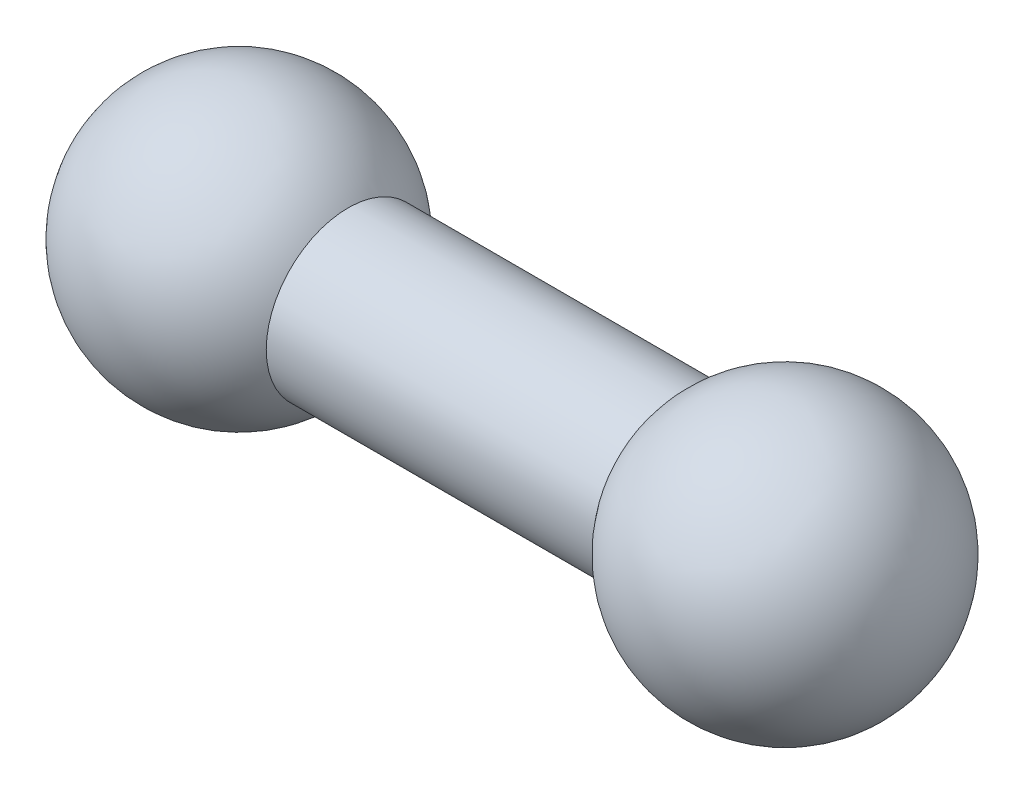
from build123d import *

# Parameters (mm, degrees)
SKETCH5_R   = 1.5
SHAFT_DEPTH = 10


with BuildPart() as part:
    # Sketch4 → Semi-circle Revolve (revolve)
    with BuildSketch(Plane(origin=(0, 0, 0), x_dir=(0, 0, -1), z_dir=(1, 0, 0))):
        with BuildLine():
            Line((0, 0), (2.5, 0))
            Line((2.5, 0), (2.5, -2.5))
            ThreePointArc((2.5, -2.5), (0.732233047, -1.767766953), (0, 0))
        make_face()
    semi_circle_revolve = revolve(axis=Axis((0, 0, -2.5), (0, -1, 0)))

    # Full-circle Mirror: Semi-circle Revolve across plane
    add(semi_circle_revolve.mirror(Plane(origin=(0, 0, 0), x_dir=(0, 0, 1), z_dir=(0, -1, 0))))

    # Sketch5 → Shaft (add)
    with BuildSketch(Plane(origin=(0, 0, 0), x_dir=(0, 0, -1), z_dir=(1, 0, 0))):
        with Locations(Location((2.5, 0, 0), (0, 0, 180))):
            Circle(SKETCH5_R)
    extrude(amount=SHAFT_DEPTH)

    # Sketch6 → Opposite Semi-circle Revolve (revolve)
    with BuildSketch(Plane(origin=(10, 0, 0), x_dir=(0, 0, -1), z_dir=(1, 0, 0))):
        with BuildLine():
            Line((0, 0), (2.5, 0))
            Line((2.5, 0), (2.5, -2.5))
            ThreePointArc((2.5, -2.5), (0.732233047, -1.767766953), (0, 0))
        make_face()
    opposite_semi_circle_revolve = revolve(axis=Axis((10, 0, -2.5), (0, -1, 0)))

    # Opposite Full-circle Mirror: Opposite Semi-circle Revolve across plane
    add(opposite_semi_circle_revolve.mirror(Plane(origin=(10, 0, 0), x_dir=(0, 0, 1), z_dir=(0, 1, 0))))


solid = part.part
